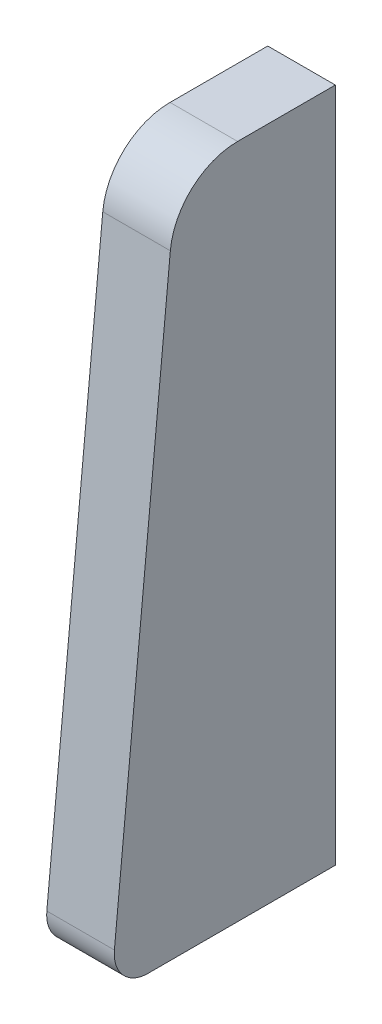
from build123d import *

# Parameters (mm, degrees)
BOSS_EXTRUDE1_DEPTH        = 6.35
F_10_24_TAPPED_HOLE1_D     = 3.7973
F_10_24_TAPPED_HOLE1_DEPTH = 14.9606
F_10_24_TAPPED_HOLE1_TIP   = 1.140824014
FILLET1_R                  = 12.7


with BuildPart() as part:
    # Sketch1 → Boss-Extrude1 (new, symmetric)
    with BuildSketch(Plane(origin=(0, 0, 0), x_dir=(0, 0, -1), z_dir=(1, 0, 0))):
        with BuildLine():
            Line((0, 0), (0, 127))
            Line((0, 127), (-29.89679252, 127))
            Line((-29.89679252, 127), (-41.522242414, 6.962121916))
            ThreePointArc((-41.522242414, 6.962121916), (-39.903382192, 2.08177286), (-35.201814678, 0))
            Line((-35.201814678, 0), (0, 0))
        make_face()
    extrude(amount=BOSS_EXTRUDE1_DEPTH, both=True)

    # #10-24 Tapped Hole1
    with Locations(Plane(origin=(0, 0, 0), x_dir=(-1, 0, 0), z_dir=(0, 0, -1))):
        with Locations((0, 12.7), (0, 69.85)):
            Hole(F_10_24_TAPPED_HOLE1_D / 2, depth=F_10_24_TAPPED_HOLE1_DEPTH)
            with Locations((0, 0, -(F_10_24_TAPPED_HOLE1_DEPTH + F_10_24_TAPPED_HOLE1_TIP / 2))):  # 118° drill point
                Cone(0, F_10_24_TAPPED_HOLE1_D / 2, F_10_24_TAPPED_HOLE1_TIP, mode=Mode.SUBTRACT)

    # Fillet1
    fillet1_edges = [part.edges().sort_by_distance(p)[0] for p in [
        (0, 127, 29.89679252),
    ]]
    fillet(fillet1_edges, radius=FILLET1_R)


solid = part.part
